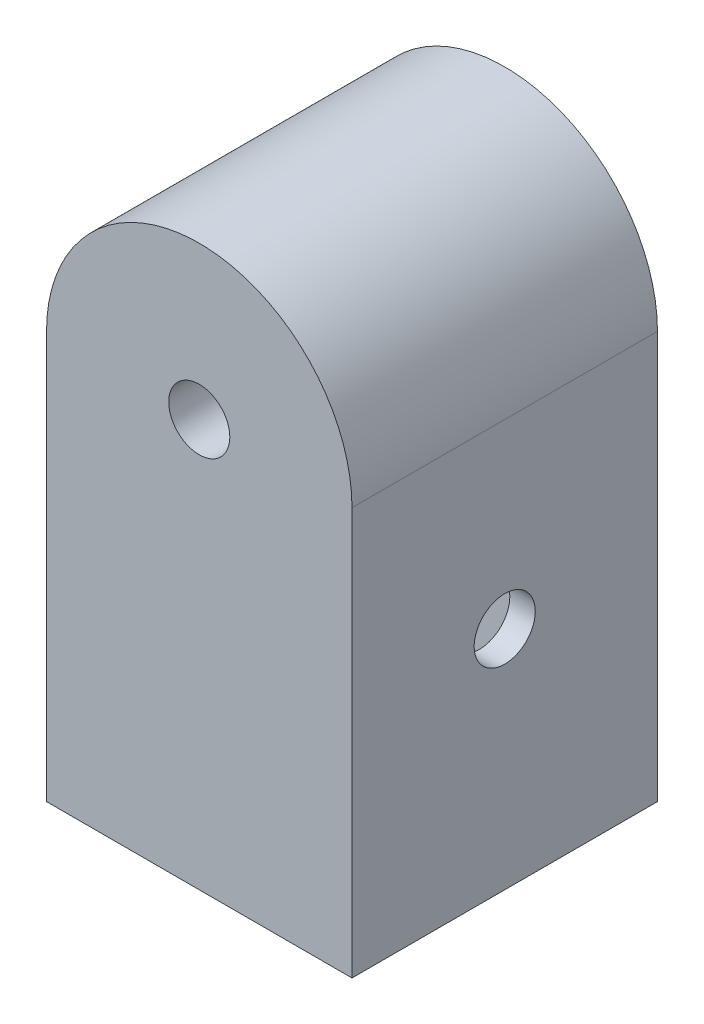
from build123d import *

# Parameters (mm, degrees)
SKETCH1_W           = 15
SKETCH1_H           = 15
BOSS_EXTRUDE1_DEPTH = 20
CUT_EXTRUDE1_START  = -3
SKETCH2_W           = 12.5
SKETCH2_H           = 12.5
CUT_EXTRUDE1_DEPTH  = 17
BOSS_EXTRUDE3_DEPTH = 15
SKETCH6_R           = 1.5
CUT_EXTRUDE2_DEPTH  = 33.210246817
SKETCH7_R           = 1.5
CUT_EXTRUDE3_DEPTH  = 33.210246817


with BuildPart() as part:
    # Sketch1 → Boss-Extrude1 (new body)
    with BuildSketch(Plane(origin=(0, 0, 0), x_dir=(1, 0, 0), z_dir=(0, 1, 0))):
        Rectangle(SKETCH1_W, SKETCH1_H)
    extrude(amount=BOSS_EXTRUDE1_DEPTH)

    # Sketch2 → Cut-Extrude1 (cut)
    with BuildSketch(Plane(origin=(0, 20, 0), x_dir=(1, 0, 0), z_dir=(0, 1, 0)).offset(CUT_EXTRUDE1_START)):
        Rectangle(SKETCH2_W, SKETCH2_H)
    extrude(amount=-CUT_EXTRUDE1_DEPTH, mode=Mode.SUBTRACT)

    # Sketch5 → Boss-Extrude3 (add, through all)
    with BuildSketch(Plane(origin=(0, 0, -7.5), x_dir=(-1, 0, 0), z_dir=(0, 0, -1))):
        with BuildLine():
            Line((-7.5, 20), (7.5, 20))
            ThreePointArc((7.5, 20), (0, 27.5), (-7.5, 20))
        make_face()
    extrude(amount=-BOSS_EXTRUDE3_DEPTH)

    # Sketch6 → Cut-Extrude2 (cut, through all)
    with BuildSketch(Plane(origin=(7.5, 0, 0), x_dir=(0, 0, -1), z_dir=(1, 0, 0))):
        with Locations((0, 11.096857515)):
            Circle(SKETCH6_R)
    extrude(amount=-CUT_EXTRUDE2_DEPTH, mode=Mode.SUBTRACT)

    # Sketch7 → Cut-Extrude3 (cut, through all)
    with BuildSketch(Plane.XY.offset(7.5)):
        with Locations((0, 20)):
            Circle(SKETCH7_R)
    extrude(amount=-CUT_EXTRUDE3_DEPTH, mode=Mode.SUBTRACT)


solid = part.part
